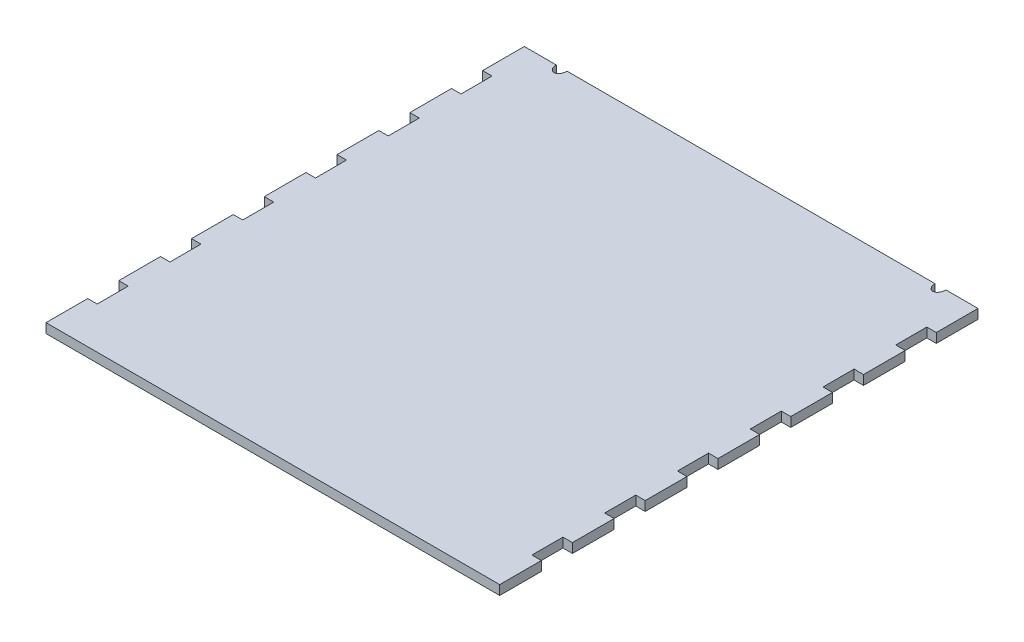
from build123d import *

# Parameters (mm, degrees)
BOSS_EXTRUDE1_DEPTH = 6.096


with BuildPart() as part:
    # Sketch1 → Boss-Extrude1 (new body)
    with BuildSketch(Plane(origin=(0, 0, 0), x_dir=(1, 0, 0), z_dir=(0, 1, 0))):
        with BuildLine():
            Line((-146.096, 127.163727148), (-140, 127.163727148))
            Line((-140, 127.163727148), (-140, 107.163727148))
            Line((-140, 107.163727148), (-146.096, 107.163727148))
            Line((-146.096, 107.163727148), (-146.096, 80.298236289))
            Line((-146.096, 80.298236289), (-140, 80.298236289))
            Line((-140, 80.298236289), (-140, 60.298236289))
            Line((-140, 60.298236289), (-146.096, 60.298236289))
            Line((-146.096, 60.298236289), (-146.096, 33.43274543))
            Line((-146.096, 33.43274543), (-140, 33.43274543))
            Line((-140, 33.43274543), (-140, 13.43274543))
            Line((-140, 13.43274543), (-146.096, 13.43274543))
            Line((-146.096, 13.43274543), (-146.096, -13.43274543))
            Line((-146.096, -13.43274543), (-140, -13.43274543))
            Line((-140, -13.43274543), (-140, -33.43274543))
            Line((-140, -33.43274543), (-146.096, -33.43274543))
            Line((-146.096, -33.43274543), (-146.096, -60.298236289))
            Line((-146.096, -60.298236289), (-140, -60.298236289))
            Line((-140, -60.298236289), (-140, -80.298236289))
            Line((-140, -80.298236289), (-146.096, -80.298236289))
            Line((-146.096, -80.298236289), (-146.096, -107.163727148))
            Line((-146.096, -107.163727148), (-140, -107.163727148))
            Line((-140, -107.163727148), (-140, -127.163727148))
            Line((-140, -127.163727148), (-146.096, -127.163727148))
            Line((-146.096, -127.163727148), (-146.096, -154.029218007))
            Line((-146.096, -154.029218007), (146.096, -154.029218007))
            Line((146.096, -154.029218007), (146.096, -127.163727148))
            Line((146.096, -127.163727148), (140, -127.163727148))
            Line((140, -127.163727148), (140, -107.163727148))
            Line((140, -107.163727148), (146.096, -107.163727148))
            Line((146.096, -107.163727148), (146.096, -80.298236289))
            Line((146.096, -80.298236289), (140, -80.298236289))
            Line((140, -80.298236289), (140, -60.298236289))
            Line((140, -60.298236289), (146.096, -60.298236289))
            Line((146.096, -60.298236289), (146.096, -33.43274543))
            Line((146.096, -33.43274543), (140, -33.43274543))
            Line((140, -33.43274543), (140, -13.43274543))
            Line((140, -13.43274543), (146.096, -13.43274543))
            Line((146.096, -13.43274543), (146.096, 13.43274543))
            Line((146.096, 13.43274543), (140, 13.43274543))
            Line((140, 13.43274543), (140, 33.43274543))
            Line((140, 33.43274543), (146.096, 33.43274543))
            Line((146.096, 33.43274543), (146.096, 60.298236289))
            Line((146.096, 60.298236289), (140, 60.298236289))
            Line((140, 60.298236289), (140, 80.298236289))
            Line((140, 80.298236289), (146.096, 80.298236289))
            Line((146.096, 80.298236289), (146.096, 107.163727148))
            Line((146.096, 107.163727148), (140, 107.163727148))
            Line((140, 107.163727148), (140, 127.163727148))
            Line((140, 127.163727148), (146.096, 127.163727148))
            Line((146.096, 127.163727148), (146.096, 154.029218007))
            Line((146.096, 154.029218007), (125.5, 154.029218007))
            add(Edge.make_bspline(
                [(118.5, 154.029218007), (118.5, 149.029218007), (122, 149.029218007), (125.5, 149.029218007), (125.5, 154.029218007)],
                knots=[1.570796327, 1.570796327, 1.570796327, 3.141592654, 3.141592654, 4.71238898, 4.71238898, 4.71238898], degree=2, weights=[1, 0.707106781, 1, 0.707106781, 1]))
            Line((118.5, 154.029218007), (-118.5, 154.029218007))
            add(Edge.make_bspline(
                [(-125.5, 154.029218007), (-125.5, 149.029218007), (-122, 149.029218007), (-118.5, 149.029218007), (-118.5, 154.029218007)],
                knots=[4.71238898, 4.71238898, 4.71238898, 6.283185307, 6.283185307, 7.853981634, 7.853981634, 7.853981634], degree=2, weights=[1, 0.707106781, 1, 0.707106781, 1]))
            Line((-125.5, 154.029218007), (-146.096, 154.029218007))
            Line((-146.096, 154.029218007), (-146.096, 127.163727148))
        make_face()
    extrude(amount=BOSS_EXTRUDE1_DEPTH)


solid = part.part
